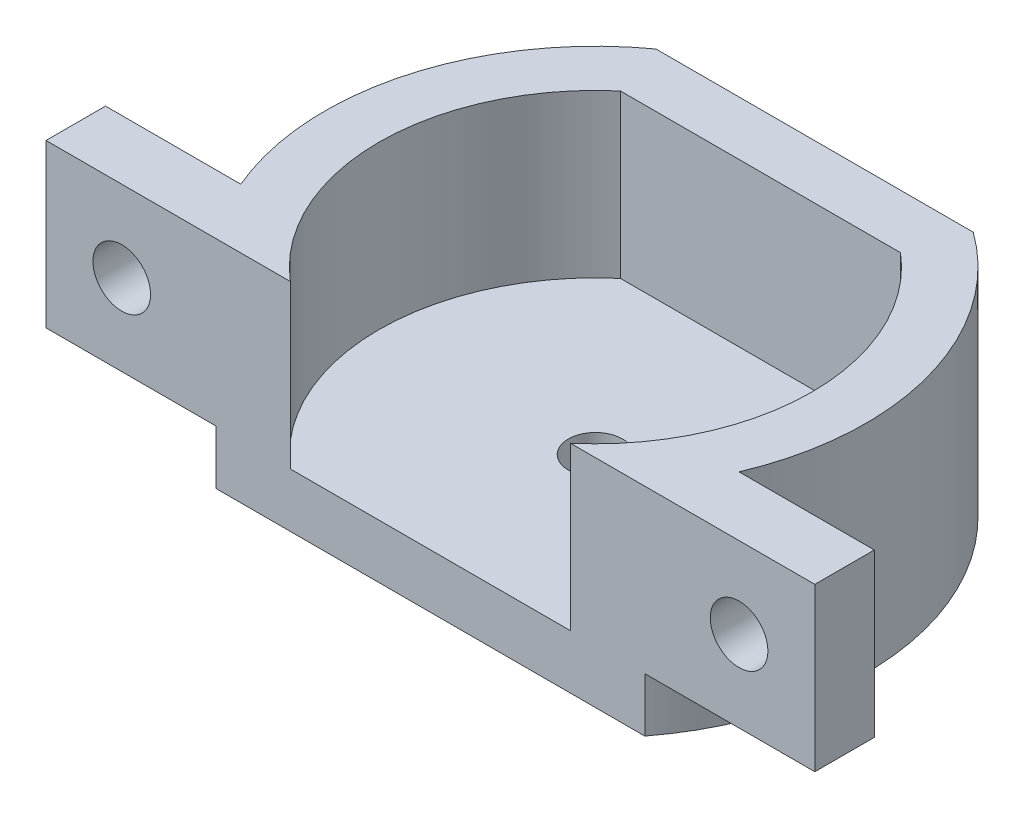
from build123d import *

# Parameters (mm, degrees)
BOSS_EXTRUDE1_DEPTH           = 7.62
BOSS_EXTRUDE2_START           = 2.54
SKETCH3_R                     = 1.27
BOSS_EXTRUDE2_DEPTH           = 2.54
TAP_DRILL_FOR_6_32_TAP1_D     = 2.7051
TAP_DRILL_FOR_6_32_TAP1_DEPTH = 7.62
TAP_DRILL_FOR_6_32_TAP1_TIP   = 0.81269403


with BuildPart() as part:
    # Sketch2 → Boss-Extrude1 (new body)
    with BuildSketch(Plane(origin=(0, 0, 0), x_dir=(1, 0, 0), z_dir=(0, 1, 0))):
        with BuildLine():
            Line((-7.447659431, 10.287), (7.447659431, 10.287))
            ThreePointArc((7.447659431, 10.287), (12.233908558, 3.409029391), (11.694348678, -4.953))
            Line((11.694348678, -4.953), (18.044348678, -4.953))
            Line((18.044348678, -4.953), (18.044348678, -7.747))
            Line((18.044348678, -7.747), (10.063497951, -7.747))
            Line((10.063497951, -7.747), (6.573400262, -7.747))
            ThreePointArc((6.573400262, -7.747), (10.16, 0), (6.573400262, 7.747))
            Line((6.573400262, 7.747), (-6.573400262, 7.747))
            ThreePointArc((-6.573400262, 7.747), (-10.16, 0), (-6.573400262, -7.747))
            Line((-6.573400262, -7.747), (-10.063497951, -7.747))
            Line((-10.063497951, -7.747), (-18.044348678, -7.747))
            Line((-18.044348678, -7.747), (-18.044348678, -4.953))
            Line((-18.044348678, -4.953), (-11.694348678, -4.953))
            ThreePointArc((-11.694348678, -4.953), (-12.233908558, 3.409029391), (-7.447659431, 10.287))
        make_face()
    extrude(amount=BOSS_EXTRUDE1_DEPTH)

    # Sketch3 → Boss-Extrude2 (add)
    with BuildSketch(Plane.XZ.offset(BOSS_EXTRUDE2_START)):
        with BuildLine():
            Line((7.447659431, -10.287), (-7.447659431, -10.287))
            ThreePointArc((-7.447659431, -10.287), (-12.568470361, -1.823061379), (-10.063497951, 7.747))
            Line((-10.063497951, 7.747), (10.063497951, 7.747))
            ThreePointArc((10.063497951, 7.747), (12.568470361, -1.823061379), (7.447659431, -10.287))
        make_face()
        with Locations(Location((0, 0, 0), (0, 0, 270))):
            Circle(SKETCH3_R, mode=Mode.SUBTRACT)
    extrude(amount=-BOSS_EXTRUDE2_DEPTH)

    # Tap Drill for #6-32 Tap1
    with Locations(Plane(origin=(0, 0, 4.953), x_dir=(-1, 0, 0), z_dir=(0, 0, -1))):
        with Locations((-14.488348678, 3.81), (14.488348678, 3.81)):
            Hole(TAP_DRILL_FOR_6_32_TAP1_D / 2, depth=TAP_DRILL_FOR_6_32_TAP1_DEPTH)
            with Locations((0, 0, -(TAP_DRILL_FOR_6_32_TAP1_DEPTH + TAP_DRILL_FOR_6_32_TAP1_TIP / 2))):  # 118° drill point
                Cone(0, TAP_DRILL_FOR_6_32_TAP1_D / 2, TAP_DRILL_FOR_6_32_TAP1_TIP, mode=Mode.SUBTRACT)


solid = part.part
